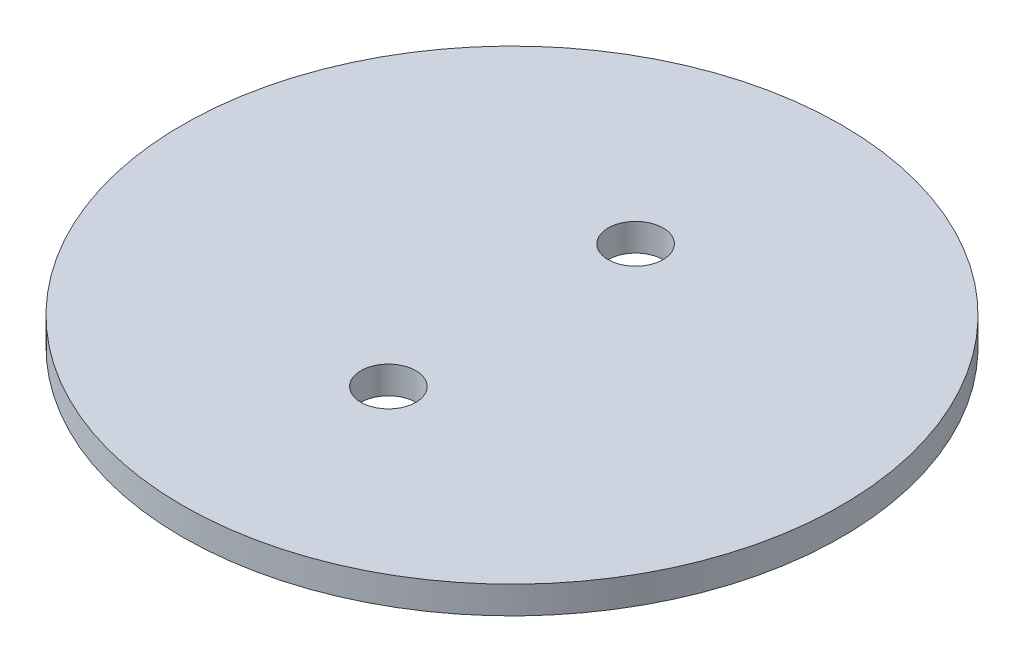
from build123d import *

# Parameters (mm, degrees)
SKETCH1_R           = 36
SKETCH1_R_2         = 3
BOSS_EXTRUDE1_DEPTH = 3


with BuildPart() as part:
    # Sketch1 → Boss-Extrude1 (new body)
    with BuildSketch(Plane(origin=(0, 0, 0), x_dir=(1, 0, 0), z_dir=(0, 1, 0))):
        with Locations(Location((0, 0, 0), (0, 0, 270))):
            Circle(SKETCH1_R)
        with Locations(Location((0, 13.5, 0), (0, 0, 270))):
            Circle(SKETCH1_R_2, mode=Mode.SUBTRACT)
        with Locations(Location((0, -13.5, 0), (0, 0, 270))):
            Circle(SKETCH1_R_2, mode=Mode.SUBTRACT)
    extrude(amount=-BOSS_EXTRUDE1_DEPTH)


solid = part.part
